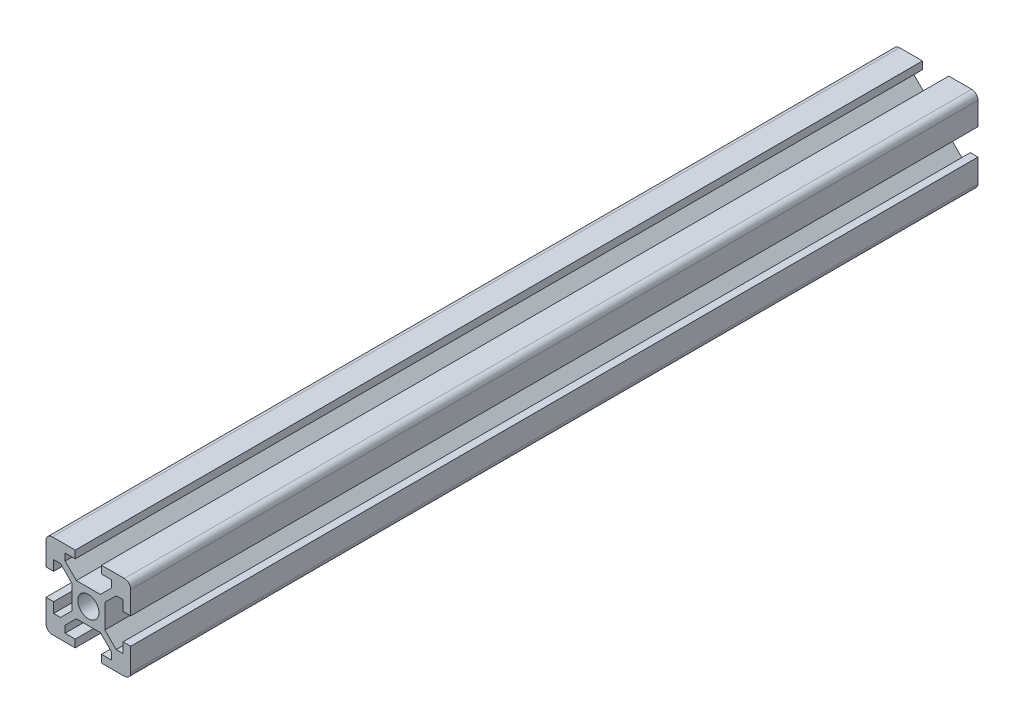
from build123d import *

# Parameters (mm, degrees)
ESQUISSE1_R        = 2.5
BOSS_EXTRU_1_DEPTH = 200


with BuildPart() as part:
    # Esquisse1 → Boss.-Extru.1 (new body)
    with BuildSketch(Plane.XY):
        with BuildLine():
            Line((-3.1, -10), (-3.1, -8.2))
            Line((-3.1, -8.2), (-5.5, -8.2))
            Line((-5.5, -8.2), (-5.5, -6.560660172))
            Line((-5.5, -6.560660172), (-2.839339828, -3.9))
            Line((-2.839339828, -3.9), (2.839339828, -3.9))
            Line((2.839339828, -3.9), (5.5, -6.560660172))
            Line((5.5, -6.560660172), (5.5, -8.2))
            Line((5.5, -8.2), (3.1, -8.2))
            Line((3.1, -8.2), (3.1, -10))
            Line((3.1, -10), (8.5, -10))
            ThreePointArc((8.5, -10), (9.560660172, -9.560660172), (10, -8.5))
            Line((10, -8.5), (10, -3.1))
            Line((10, -3.1), (8.2, -3.1))
            Line((8.2, -3.1), (8.2, -5.5))
            Line((8.2, -5.5), (6.560660172, -5.5))
            Line((6.560660172, -5.5), (3.9, -2.839339828))
            Line((3.9, -2.839339828), (3.9, 2.839339828))
            Line((3.9, 2.839339828), (6.560660172, 5.5))
            Line((6.560660172, 5.5), (8.2, 5.5))
            Line((8.2, 5.5), (8.2, 3.1))
            Line((8.2, 3.1), (10, 3.1))
            Line((10, 3.1), (10, 8.5))
            ThreePointArc((10, 8.5), (9.560660172, 9.560660172), (8.5, 10))
            Line((8.5, 10), (3.1, 10))
            Line((3.1, 10), (3.1, 8.2))
            Line((3.1, 8.2), (5.5, 8.2))
            Line((5.5, 8.2), (5.5, 6.560660172))
            Line((5.5, 6.560660172), (2.839339828, 3.9))
            Line((2.839339828, 3.9), (-2.839339828, 3.9))
            Line((-2.839339828, 3.9), (-5.5, 6.560660172))
            Line((-5.5, 6.560660172), (-5.5, 8.2))
            Line((-5.5, 8.2), (-3.1, 8.2))
            Line((-3.1, 8.2), (-3.1, 10))
            Line((-3.1, 10), (-8.5, 10))
            ThreePointArc((-8.5, 10), (-9.560660172, 9.560660172), (-10, 8.5))
            Line((-10, 8.5), (-10, 3.1))
            Line((-10, 3.1), (-8.2, 3.1))
            Line((-8.2, 3.1), (-8.2, 5.5))
            Line((-8.2, 5.5), (-6.560660172, 5.5))
            Line((-6.560660172, 5.5), (-3.9, 2.839339828))
            Line((-3.9, 2.839339828), (-3.9, -2.839339828))
            Line((-3.9, -2.839339828), (-6.560660172, -5.5))
            Line((-6.560660172, -5.5), (-8.2, -5.5))
            Line((-8.2, -5.5), (-8.2, -3.1))
            Line((-8.2, -3.1), (-10, -3.1))
            Line((-10, -3.1), (-10, -8.5))
            ThreePointArc((-10, -8.5), (-9.560660172, -9.560660172), (-8.5, -10))
            Line((-8.5, -10), (-3.1, -10))
        make_face()
        Circle(ESQUISSE1_R, mode=Mode.SUBTRACT)
    extrude(amount=BOSS_EXTRU_1_DEPTH)


solid = part.part
